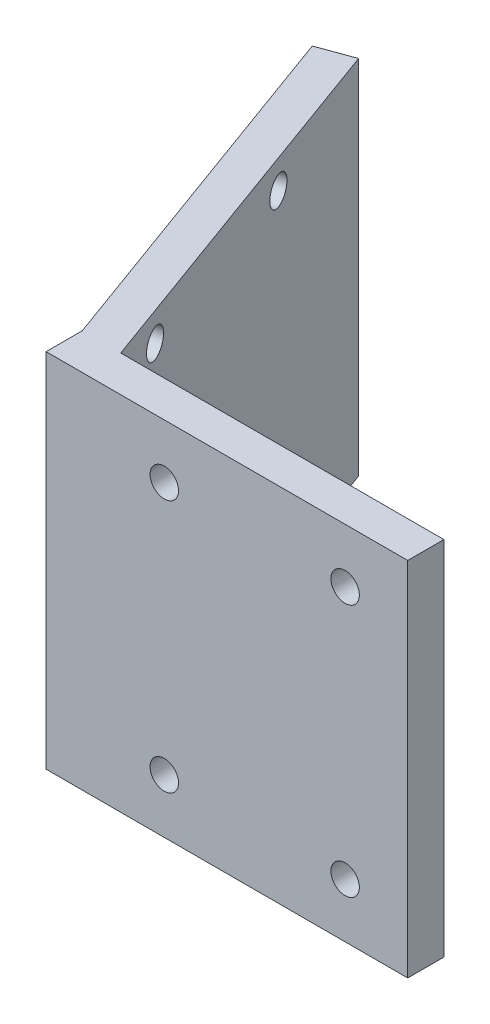
from build123d import *

# Parameters (mm, degrees)
BOSS_EXTRUDE1_DEPTH = 25.4
CUT_EXTRUDE1_DEPTH  = 25.4
SKETCH2_4_R         = 1
CUT_EXTRUDE2_DEPTH  = 25.4
SKETCH2_5_R         = 1
CUT_EXTRUDE3_DEPTH  = 25.4
SKETCH2_6_R         = 1
CUT_EXTRUDE4_DEPTH  = 25.4
SKETCH3_R           = 1
CUT_EXTRUDE5_DEPTH  = 25.4


with BuildPart() as part:
    # Sketch1 → Boss-Extrude1 (new body)
    with BuildSketch(Plane(origin=(0, 0, 0), x_dir=(1, 0, 0), z_dir=(0, 1, 0))):
        Polygon((0, 0), (0, -2.54), (25.4, -2.54), (25.4, 0), (2.703011542, 0), (2.386819257, 0.868731164), (-6.858024694, 26.268731164), (-9.24484395, 25.4), align=None)
    extrude(amount=BOSS_EXTRUDE1_DEPTH)

    # Sketch2 → Cut-Extrude1 (cut)
    with BuildSketch(Plane(origin=(0, 0, 0), x_dir=(0.3420201433256697, 0, 0.9396926207859081), z_dir=(-0.939692620785908, 0, 0.34202014332566966))):
        with BuildLine():
            ThreePointArc((-18.604115421, 2), (-17.604115421, 1), (-16.604115421, 2))
            ThreePointArc((-16.604115421, 2), (-17.604115421, 3), (-18.604115421, 2))
        make_face()
    extrude(amount=-CUT_EXTRUDE1_DEPTH, mode=Mode.SUBTRACT)

    # Sketch2<4> → Cut-Extrude2 (cut)
    with BuildSketch(Plane(origin=(0, 0, 0), x_dir=(0.3420201433256697, 0, 0.9396926207859081), z_dir=(-0.939692620785908, 0, 0.34202014332566966))):
        with Locations((-17.604115421, 23.4)):
            Circle(SKETCH2_4_R)
    extrude(amount=-CUT_EXTRUDE2_DEPTH, mode=Mode.SUBTRACT)

    # Sketch2<5> → Cut-Extrude3 (cut)
    with BuildSketch(Plane(origin=(0, 0, 0), x_dir=(0.3420201433256697, 0, 0.9396926207859081), z_dir=(-0.939692620785908, 0, 0.34202014332566966))):
        with Locations((-3.104115421, 2)):
            Circle(SKETCH2_5_R)
    extrude(amount=-CUT_EXTRUDE3_DEPTH, mode=Mode.SUBTRACT)

    # Sketch2<6> → Cut-Extrude4 (cut)
    with BuildSketch(Plane(origin=(0, 0, 0), x_dir=(0.3420201433256697, 0, 0.9396926207859081), z_dir=(-0.939692620785908, 0, 0.34202014332566966))):
        with Locations((-3.104115421, 23.4)):
            Circle(SKETCH2_6_R)
    extrude(amount=-CUT_EXTRUDE4_DEPTH, mode=Mode.SUBTRACT)

    # Sketch3 → Cut-Extrude5 (cut)
    with BuildSketch(Plane(origin=(0, 0, 0), x_dir=(-1, 0, 0), z_dir=(0, 0, -1))):
        with Locations((-21.001496496, 21.59)):
            Circle(SKETCH3_R)
        with Locations((-21.001496496, 3.81)):
            Circle(SKETCH3_R)
        with Locations((-8.301496496, 21.59)):
            Circle(SKETCH3_R)
        with Locations((-8.301496496, 3.81)):
            Circle(SKETCH3_R)
    extrude(amount=-CUT_EXTRUDE5_DEPTH, mode=Mode.SUBTRACT)


solid = part.part
